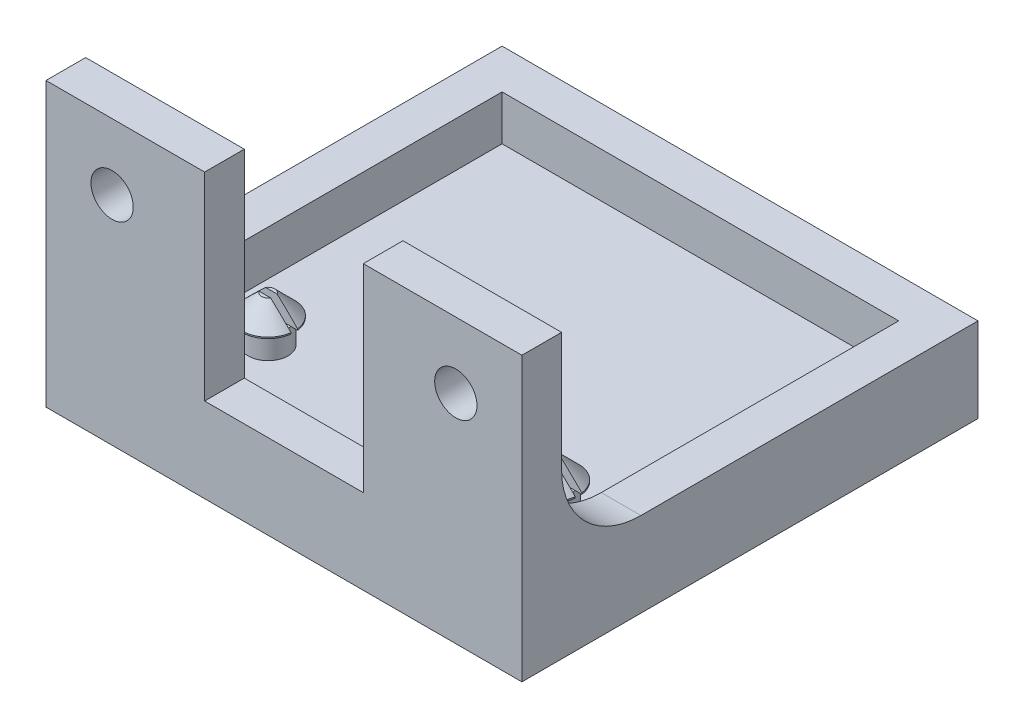
from build123d import *

# Parameters (mm, degrees)
SKETCH1_W           = 36
SKETCH1_H           = 34.5
BOSS_EXTRUDE1_DEPTH = 3
SKETCH2_W           = 36
SKETCH2_H           = 34.5
SKETCH2_W_2         = 30
SKETCH2_H_2         = 28.5
SKETCH2_R           = 1.5
BOSS_EXTRUDE2_DEPTH = 1.8
SKETCH3_W           = 36
SKETCH3_H           = 34.5
SKETCH3_W_2         = 30
SKETCH3_H_2         = 28.5
BOSS_EXTRUDE3_DEPTH = 1.6
CHAMFER1_SIZE       = 1.5
SKETCH5_W           = 12
SKETCH5_H           = 3
BOSS_EXTRUDE4_DEPTH = 15
SKETCH6_R           = 1.6
CUT_EXTRUDE1_DEPTH  = 55.260575006
FILLET1_R           = 6


with BuildPart() as part:
    # Sketch1 → Boss-Extrude1 (new body)
    with BuildSketch(Plane(origin=(0, 0, 0), x_dir=(1, 0, 0), z_dir=(0, 1, 0))):
        with Locations((18, 17.25)):
            Rectangle(SKETCH1_W, SKETCH1_H)
    extrude(amount=BOSS_EXTRUDE1_DEPTH)

    # Sketch2 → Boss-Extrude2 (add)
    # profile 1 of 3: a face of its own
    with BuildSketch(Plane(origin=(0, 3, 0), x_dir=(1, 0, 0), z_dir=(0, 1, 0))):
        with Locations((18, 17.25)):
            Rectangle(SKETCH2_W, SKETCH2_H)
        with Locations((18, 17.25)):
            Rectangle(SKETCH2_W_2, SKETCH2_H_2, mode=Mode.SUBTRACT)
    # profile 2 of 3: a face of its own
    with BuildSketch(Plane(origin=(0, 3, 0), x_dir=(1, 0, 0), z_dir=(0, 1, 0))):
        with Locations(Location((7.3, 9.5, 0), (0, 0, 90))):
            Circle(SKETCH2_R)
    # profile 3 of 3: a face of its own
    with BuildSketch(Plane(origin=(0, 3, 0), x_dir=(1, 0, 0), z_dir=(0, 1, 0))):
        with Locations(Location((28.8, 9.5, 0), (0, 0, 90))):
            Circle(SKETCH2_R)
    extrude(amount=BOSS_EXTRUDE2_DEPTH)

    # Sketch3 → Boss-Extrude3 (add)
    # profile 1 of 5: a face of its own
    with BuildSketch(Plane(origin=(0, 4.8, 0), x_dir=(1, 0, 0), z_dir=(0, 1, 0))):
        with Locations((18, 17.25)):
            Rectangle(SKETCH3_W, SKETCH3_H)
        with Locations((18, 17.25)):
            Rectangle(SKETCH3_W_2, SKETCH3_H_2, mode=Mode.SUBTRACT)
    # profile 2 of 5: a face of its own
    with BuildSketch(Plane(origin=(0, 4.8, 0), x_dir=(1, 0, 0), z_dir=(0, 1, 0))):
        with BuildLine():
            ThreePointArc((30.784313483, 9.75), (28.8, 11.5), (26.815686517, 9.75))
            Line((26.815686517, 9.75), (30.784313483, 9.75))
        make_face()
    # profile 3 of 5: a face of its own
    with BuildSketch(Plane(origin=(0, 4.8, 0), x_dir=(1, 0, 0), z_dir=(0, 1, 0))):
        with BuildLine():
            ThreePointArc((26.815686517, 9.25), (28.8, 7.5), (30.784313483, 9.25))
            Line((30.784313483, 9.25), (26.815686517, 9.25))
        make_face()
    # profile 4 of 5: a face of its own
    with BuildSketch(Plane(origin=(0, 4.8, 0), x_dir=(1, 0, 0), z_dir=(0, 1, 0))):
        with BuildLine():
            ThreePointArc((9.284313483, 9.75), (7.3, 11.5), (5.315686517, 9.75))
            Line((5.315686517, 9.75), (9.284313483, 9.75))
        make_face()
    # profile 5 of 5: a face of its own
    with BuildSketch(Plane(origin=(0, 4.8, 0), x_dir=(1, 0, 0), z_dir=(0, 1, 0))):
        with BuildLine():
            ThreePointArc((5.315686517, 9.25), (7.3, 7.5), (9.284313483, 9.25))
            Line((9.284313483, 9.25), (5.315686517, 9.25))
        make_face()
    extrude(amount=BOSS_EXTRUDE3_DEPTH)

    # Chamfer1
    chamfer1_edges = [part.edges().sort_by_distance(p)[0] for p in [
        (7.3, 6.4, -11.5),
        (7.3, 6.4, -7.5),
        (28.8, 6.4, -11.5),
        (28.8, 6.4, -7.5),
    ]]
    chamfer(chamfer1_edges, length=CHAMFER1_SIZE)

    # Sketch5 → Boss-Extrude4 (add)
    with BuildSketch(Plane(origin=(0, 6.4, 0), x_dir=(1, 0, 0), z_dir=(0, 1, 0))):
        with Locations((6, 1.5)):
            Rectangle(SKETCH5_W, SKETCH5_H)
        with Locations((30, 1.5)):
            Rectangle(SKETCH5_W, SKETCH5_H)
    extrude(amount=BOSS_EXTRUDE4_DEPTH)

    # Sketch6 → Cut-Extrude1 (cut, through all)
    with BuildSketch(Plane.XY):
        with Locations((5, 16.4)):
            Circle(SKETCH6_R)
        with Locations((31, 16.4)):
            Circle(SKETCH6_R)
    extrude(amount=-CUT_EXTRUDE1_DEPTH, mode=Mode.SUBTRACT)

    # Fillet1
    fillet1_edges = [part.edges().sort_by_distance(p)[0] for p in [
        (1.5, 6.4, -3),
        (34.5, 6.4, -3),
    ]]
    fillet(fillet1_edges, radius=FILLET1_R)


solid = part.part
